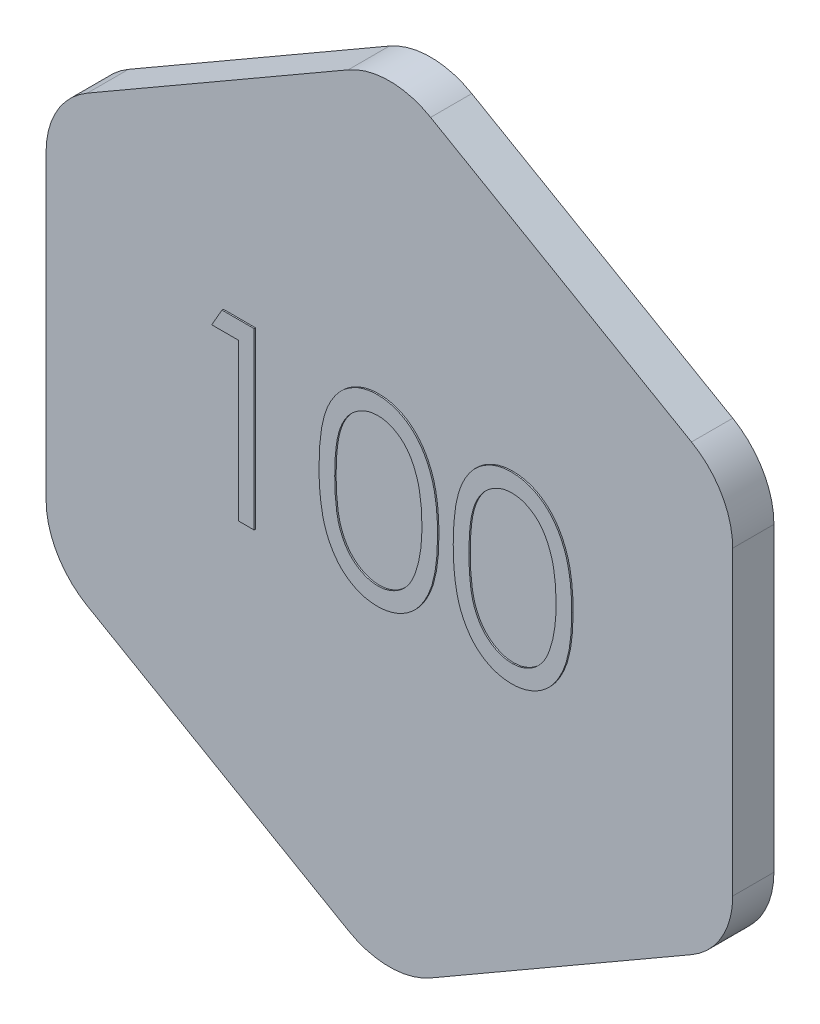
from build123d import *

# Parameters (mm, degrees)
BOSS_EXTRUDE2_DEPTH = 3
BOSS_EXTRUDE3_DEPTH = 0.1


with BuildPart() as part:
    # Sketch1 → Boss-Extrude2 (new body)
    with BuildSketch(Plane(origin=(0, 0, 0), x_dir=(0, 1, 0), z_dir=(0, 0, 1))):
        with BuildLine():
            Line((16.165807537, -22), (27.135462652, -3))
            ThreePointArc((27.135462652, -3), (27.939310229, 0), (27.135462652, 3))
            Line((27.135462652, 3), (16.165807537, 22))
            ThreePointArc((16.165807537, 22), (13.969655115, 24.196152423), (10.969655115, 25))
            Line((10.969655115, 25), (-10.969655115, 25))
            ThreePointArc((-10.969655115, 25), (-13.969655115, 24.196152423), (-16.165807537, 22))
            Line((-16.165807537, 22), (-27.135462652, 3))
            ThreePointArc((-27.135462652, 3), (-27.939310229, 0), (-27.135462652, -3))
            Line((-27.135462652, -3), (-16.165807537, -22))
            ThreePointArc((-16.165807537, -22), (-13.969655115, -24.196152423), (-10.969655115, -25))
            Line((-10.969655115, -25), (10.969655115, -25))
            ThreePointArc((10.969655115, -25), (13.969655115, -24.196152423), (16.165807537, -22))
        make_face()
    extrude(amount=BOSS_EXTRUDE2_DEPTH)

    # Sketch2 → Boss-Extrude3 (add)
    # profile 1 of 3: a face of its own
    with BuildSketch(Plane.XY.offset(3)):
        Polygon((-12.091106581, 7.490425422), (-9.742929497, 7.490425422), (-9.742929497, -5.209574578), (-10.882673087, -5.209574578), (-10.882673087, 6.18786132), (-12.836519241, 6.18786132), align=None)
    # profile 2 of 3: a face of its own
    with BuildSketch(Plane.XY.offset(3)):
        with BuildLine():
            add(Edge.make_bspline(
                [(-5.021134625, 1.135337281), (-5.019944388, 1.33889066), (-5.017632335, 1.734296031), (-4.991911493, 2.310457447), (-4.949183823, 2.850970495), (-4.890628213, 3.355861049), (-4.819370399, 3.825259452), (-4.724245633, 4.257911285), (-4.616067749, 4.655819), (-4.490691731, 5.020280148), (-4.349221754, 5.356204956), (-4.195246008, 5.669804972), (-4.022653754, 5.960605698), (-3.841308956, 6.233248537), (-3.643870867, 6.483270515), (-3.435958113, 6.714202462), (-3.209455877, 6.920707185), (-2.972063818, 7.108835197), (-2.721632647, 7.273751851), (-2.465300687, 7.419013503), (-2.201303589, 7.543110164), (-1.928920582, 7.640684031), (-1.650599872, 7.721277675), (-1.365368516, 7.776391857), (-1.072755567, 7.811069782), (-0.875247218, 7.814385091), (-0.77508094, 7.816066448)],
                knots=[0, 0, 0, 0, 1.646270934, 3.197905019, 4.663502075, 6.030701355, 7.308322542, 8.50163776, 9.611534131, 10.641858119, 11.616356847, 12.558055219, 13.465016945, 14.349605745, 15.204443733, 16.039544428, 16.859896111, 17.680448484, 18.487036065, 19.28249412, 20.06191084, 20.843045899, 21.620316918, 22.403196591, 23.190181807, 24, 24, 24, 24], degree=3))
            add(Edge.make_bspline(
                [(-0.77508094, 7.816066448), (-0.674077918, 7.814296376), (-0.473214685, 7.810776259), (-0.176251038, 7.776943668), (0.113852093, 7.720805592), (0.39585791, 7.64126377), (0.672082861, 7.542582315), (0.940366398, 7.418894776), (1.202374951, 7.274917171), (1.453944851, 7.105739102), (1.697837884, 6.9171177), (1.92806335, 6.703893159), (2.144642204, 6.468218463), (2.350292598, 6.212615129), (2.539180051, 5.932180678), (2.719060791, 5.631792622), (2.880067892, 5.30619777), (3.035133714, 4.960828644), (3.16898078, 4.586129082), (3.289689727, 4.184211237), (3.387221985, 3.750327759), (3.468463058, 3.286755097), (3.531400252, 2.791790801), (3.577238696, 2.266495885), (3.601452462, 1.710524753), (3.606012492, 1.330403414), (3.608352554, 1.135337281)],
                knots=[0, 0, 0, 0, 0.810914788, 1.612654377, 2.396697861, 3.181598691, 3.963628158, 4.749916497, 5.551656086, 6.361998678, 7.18212741, 8.025565596, 8.878627764, 9.750805457, 10.657531673, 11.591944965, 12.560506719, 13.57287815, 14.630710178, 15.753379473, 16.941251878, 18.199788006, 19.531962791, 20.947069417, 22.433333509, 24, 24, 24, 24], degree=3))
            add(Edge.make_bspline(
                [(3.608352554, 1.135337281), (3.605988233, 0.941121958), (3.60138145, 0.562701321), (3.577510142, 0.009231782), (3.530488824, -0.513275403), (3.471669723, -1.006073367), (3.3902048, -1.467111013), (3.290037483, -1.897983726), (3.178820597, -2.300552214), (3.041534344, -2.671518531), (2.891272624, -3.016057639), (2.727786626, -3.33779272), (2.552636114, -3.639567554), (2.361814097, -3.918966635), (2.158420283, -4.177969191), (1.93810145, -4.412003422), (1.707068184, -4.626708432), (1.462457418, -4.817758623), (1.206964075, -4.984980628), (0.945855424, -5.134528028), (0.674498576, -5.255115236), (0.399043005, -5.35865667), (0.115548648, -5.437761167), (-0.175631113, -5.492457729), (-0.473015169, -5.530818436), (-0.674043705, -5.533744806), (-0.77508094, -5.535215603)],
                knots=[0, 0, 0, 0, 1.561518951, 3.042555995, 4.452378317, 5.7783523, 7.031515105, 8.214008947, 9.334062868, 10.386615937, 11.391082383, 12.354592575, 13.286541444, 14.194233754, 15.072674879, 15.931287219, 16.775624067, 17.606195743, 18.42308326, 19.229000347, 20.022332153, 20.807536673, 21.593273796, 22.3848459, 23.188221202, 24, 24, 24, 24], degree=3))
            add(Edge.make_bspline(
                [(-0.77508094, -5.535215603), (-0.875244439, -5.533523399), (-1.072747309, -5.530186703), (-1.365400395, -5.495665449), (-1.649453833, -5.440164623), (-1.926309312, -5.362452945), (-2.197387238, -5.267330539), (-2.458993764, -5.143401459), (-2.714037645, -5.00067498), (-2.961838434, -4.838131593), (-3.197739704, -4.6519072), (-3.423068929, -4.445933924), (-3.632165427, -4.215071832), (-3.826780574, -3.962966225), (-4.011743694, -3.69193646), (-4.181885134, -3.398282078), (-4.339259376, -3.083167463), (-4.483108613, -2.744556758), (-4.61064805, -2.377508877), (-4.723306876, -1.977824715), (-4.812258248, -1.54197655), (-4.8883964, -1.073464961), (-4.949807733, -0.570276699), (-4.991733427, -0.03213859), (-5.017646199, 0.540614026), (-5.019950597, 0.933478635), (-5.021134625, 1.135337281)],
                knots=[0, 0, 0, 0, 0.810891512, 1.598919785, 2.382837074, 3.152667961, 3.926044502, 4.706494248, 5.493654104, 6.291793342, 7.103789334, 7.925228297, 8.761435821, 9.622817696, 10.50288917, 11.416980706, 12.369136599, 13.353924996, 14.394355917, 15.514179734, 16.714354668, 17.994756427, 19.357759367, 20.818452758, 22.365282078, 24, 24, 24, 24], degree=3))
        make_face()
        with BuildLine():
            add(Edge.make_bspline(
                [(-3.881391036, 1.140425422), (-3.880957613, 0.970794429), (-3.880116426, 0.641573981), (-3.85814107, 0.163171291), (-3.828204514, -0.28303533), (-3.789591807, -0.697612448), (-3.732249679, -1.079156779), (-3.667999335, -1.430292487), (-3.589810552, -1.749161318), (-3.497300059, -2.037951374), (-3.391929622, -2.301563709), (-3.276882631, -2.546859546), (-3.153290865, -2.776736573), (-3.014972804, -2.989129952), (-2.864332432, -3.184732319), (-2.70477232, -3.367005739), (-2.530337514, -3.529554785), (-2.289023934, -3.724506516), (-1.970448156, -3.925961659), (-1.569053932, -4.101388899), (-1.156599839, -4.211633812), (-0.876651017, -4.225653727), (-0.736919882, -4.232651501)],
                knots=[0, 0, 0, 0, 1.459021318, 2.831673884, 4.118529203, 5.306027144, 6.411944654, 7.436330062, 8.375795394, 9.233974572, 10.042671642, 10.816086306, 11.563610507, 12.285937304, 12.993564865, 13.685989202, 14.367179055, 15.041617293, 16.353048772, 17.594441528, 18.799311195, 20, 20, 20, 20], degree=3))
            add(Edge.make_bspline(
                [(-0.736919882, -4.232651501), (-0.596284902, -4.226853839), (-0.315305301, -4.215270485), (0.095208756, -4.103515067), (0.493735736, -3.934897024), (0.806053919, -3.735516075), (1.043662006, -3.545638994), (1.213903656, -3.383751556), (1.370157374, -3.202483123), (1.51835576, -3.006905678), (1.654278692, -2.793282664), (1.77787922, -2.56264132), (1.890667367, -2.31434116), (1.954925905, -2.141005249), (1.987779637, -2.052383071)],
                knots=[0, 0, 0, 0, 1.353760809, 2.704726607, 4.075137775, 5.516104923, 6.260822281, 7.007110065, 7.778089737, 8.566572457, 9.372053459, 10.217411131, 11.088608312, 12, 12, 12, 12], degree=3))
            add(Edge.make_bspline(
                [(1.987779637, -2.052383071), (2.026067481, -1.939063731), (2.103808222, -1.708976872), (2.203999517, -1.352057335), (2.282904252, -0.977578734), (2.353891322, -0.587779025), (2.402343839, -0.179783538), (2.441343047, 0.245145341), (2.464314397, 0.687327998), (2.467161922, 0.987755537), (2.468608964, 1.140425422)],
                knots=[0, 0, 0, 0, 0.884706709, 1.796334032, 2.740027952, 3.714592787, 4.726048262, 5.777819803, 6.87074269, 8, 8, 8, 8], degree=3))
            add(Edge.make_bspline(
                [(2.468608964, 1.140425422), (2.466612563, 1.293070614), (2.462707176, 1.59167724), (2.447779278, 2.028986067), (2.409230879, 2.444340514), (2.366416934, 2.839529944), (2.303289874, 3.212366756), (2.235225832, 3.56597215), (2.143781433, 3.895965411), (2.046101107, 4.207513036), (1.934303386, 4.497075411), (1.811237722, 4.766002579), (1.679804483, 5.015592866), (1.537048353, 5.245161482), (1.384664017, 5.455736709), (1.218629482, 5.643096524), (1.045530758, 5.813047808), (0.803079826, 6.007040559), (0.485673117, 6.20484014), (0.090718911, 6.386870183), (-0.320291712, 6.49140313), (-0.59814396, 6.506141252), (-0.736919882, 6.513502345)],
                knots=[0, 0, 0, 0, 1.31362396, 2.569729283, 3.763502607, 4.902122613, 5.988968491, 7.01645872, 7.998833611, 8.933434873, 9.825090667, 10.667526885, 11.477055099, 12.250526234, 12.991942729, 13.710640831, 14.402115721, 15.076753259, 16.378508321, 17.609869233, 18.806226677, 20, 20, 20, 20], degree=3))
            add(Edge.make_bspline(
                [(-0.736919882, 6.513502345), (-0.87738403, 6.506131096), (-1.158568219, 6.491375169), (-1.573850798, 6.387259649), (-1.971920874, 6.20578403), (-2.288488239, 6.006385421), (-2.531108264, 5.816472119), (-2.70195118, 5.651784129), (-2.862138719, 5.471639149), (-3.009704374, 5.274237915), (-3.147914059, 5.062092153), (-3.274845162, 4.833532921), (-3.389208044, 4.587401971), (-3.494743361, 4.323908048), (-3.587536049, 4.035142907), (-3.664077001, 3.716666845), (-3.734787165, 3.36664798), (-3.784844284, 2.983037194), (-3.829344198, 2.568356238), (-3.857942231, 2.121035683), (-3.880189937, 1.641830646), (-3.880982651, 1.310907985), (-3.881391036, 1.140425422)],
                knots=[0, 0, 0, 0, 1.207732386, 2.417664972, 3.655092373, 4.956220595, 5.625982001, 6.301752483, 6.994047911, 7.697131622, 8.419323945, 9.170223765, 9.943494443, 10.752040957, 11.610060368, 12.549350801, 13.567764191, 14.679664412, 15.874934091, 17.154273443, 18.533957287, 20, 20, 20, 20], degree=3))
        make_face(mode=Mode.SUBTRACT)
    # profile 3 of 3: a face of its own
    with BuildSketch(Plane.XY.offset(3)):
        with BuildLine():
            add(Edge.make_bspline(
                [(4.748096144, 1.135337281), (4.749286381, 1.33889066), (4.751598434, 1.734296031), (4.777319276, 2.310457447), (4.820046947, 2.850970495), (4.878602557, 3.355861049), (4.949860371, 3.825259452), (5.044985136, 4.257911285), (5.15316302, 4.655819), (5.278539038, 5.020280148), (5.420009015, 5.356204956), (5.573984761, 5.669804972), (5.746577015, 5.960605698), (5.927921813, 6.233248537), (6.125359902, 6.483270515), (6.333272656, 6.714202462), (6.559774893, 6.920707185), (6.797166951, 7.108835197), (7.047598122, 7.273751851), (7.303930082, 7.419013503), (7.56792718, 7.543110164), (7.840310187, 7.640684031), (8.118630897, 7.721277675), (8.403862253, 7.776391857), (8.696475202, 7.811069782), (8.893983552, 7.814385091), (8.99414983, 7.816066448)],
                knots=[0, 0, 0, 0, 1.646270934, 3.197905019, 4.663502075, 6.030701355, 7.308322542, 8.50163776, 9.611534131, 10.641858119, 11.616356847, 12.558055219, 13.465016945, 14.349605745, 15.204443733, 16.039544428, 16.859896111, 17.680448484, 18.487036065, 19.28249412, 20.06191084, 20.843045899, 21.620316918, 22.403196591, 23.190181807, 24, 24, 24, 24], degree=3))
            add(Edge.make_bspline(
                [(8.99414983, 7.816066448), (9.095152852, 7.814296376), (9.296016084, 7.810776259), (9.592979731, 7.776943668), (9.883082862, 7.720805592), (10.16508868, 7.64126377), (10.441313631, 7.542582315), (10.709597167, 7.418894776), (10.97160572, 7.274917171), (11.223175621, 7.105739102), (11.467068653, 6.9171177), (11.697294119, 6.703893159), (11.913872974, 6.468218463), (12.119523367, 6.212615129), (12.30841082, 5.932180678), (12.48829156, 5.631792622), (12.649298662, 5.30619777), (12.804364483, 4.960828644), (12.938211549, 4.586129082), (13.058920496, 4.184211237), (13.156452754, 3.750327759), (13.237693828, 3.286755097), (13.300631022, 2.791790801), (13.346469466, 2.266495885), (13.370683231, 1.710524753), (13.375243261, 1.330403414), (13.377583323, 1.135337281)],
                knots=[0, 0, 0, 0, 0.810914788, 1.612654377, 2.396697861, 3.181598691, 3.963628158, 4.749916497, 5.551656086, 6.361998678, 7.18212741, 8.025565596, 8.878627764, 9.750805457, 10.657531673, 11.591944965, 12.560506719, 13.57287815, 14.630710178, 15.753379473, 16.941251878, 18.199788006, 19.531962791, 20.947069417, 22.433333509, 24, 24, 24, 24], degree=3))
            add(Edge.make_bspline(
                [(13.377583323, 1.135337281), (13.375219002, 0.941121958), (13.370612219, 0.562701321), (13.346740912, 0.009231782), (13.299719593, -0.513275403), (13.240900492, -1.006073367), (13.15943557, -1.467111013), (13.059268252, -1.897983726), (12.948051366, -2.300552214), (12.810765113, -2.671518531), (12.660503393, -3.016057639), (12.497017396, -3.33779272), (12.321866884, -3.639567554), (12.131044866, -3.918966635), (11.927651053, -4.177969191), (11.707332219, -4.412003422), (11.476298953, -4.626708432), (11.231688187, -4.817758623), (10.976194844, -4.984980628), (10.715086193, -5.134528028), (10.443729345, -5.255115236), (10.168273774, -5.35865667), (9.884779417, -5.437761167), (9.593599656, -5.492457729), (9.2962156, -5.530818436), (9.095187064, -5.533744806), (8.99414983, -5.535215603)],
                knots=[0, 0, 0, 0, 1.561518951, 3.042555995, 4.452378317, 5.7783523, 7.031515105, 8.214008947, 9.334062868, 10.386615937, 11.391082383, 12.354592575, 13.286541444, 14.194233754, 15.072674879, 15.931287219, 16.775624067, 17.606195743, 18.42308326, 19.229000347, 20.022332153, 20.807536673, 21.593273796, 22.3848459, 23.188221202, 24, 24, 24, 24], degree=3))
            add(Edge.make_bspline(
                [(8.99414983, -5.535215603), (8.89398633, -5.533523399), (8.696483461, -5.530186703), (8.403830374, -5.495665449), (8.119776936, -5.440164623), (7.842921457, -5.362452945), (7.571843531, -5.267330539), (7.310237005, -5.143401459), (7.055193125, -5.00067498), (6.807392336, -4.838131593), (6.571491065, -4.6519072), (6.34616184, -4.445933924), (6.137065343, -4.215071832), (5.942450196, -3.962966225), (5.757487076, -3.69193646), (5.587345635, -3.398282078), (5.429971393, -3.083167463), (5.286122156, -2.744556758), (5.15858272, -2.377508877), (5.045923893, -1.977824715), (4.956972522, -1.54197655), (4.880834369, -1.073464961), (4.819423037, -0.570276699), (4.777497342, -0.03213859), (4.75158457, 0.540614026), (4.749280172, 0.933478635), (4.748096144, 1.135337281)],
                knots=[0, 0, 0, 0, 0.810891512, 1.598919785, 2.382837074, 3.152667961, 3.926044502, 4.706494248, 5.493654104, 6.291793342, 7.103789334, 7.925228297, 8.761435821, 9.622817696, 10.50288917, 11.416980706, 12.369136599, 13.353924996, 14.394355917, 15.514179734, 16.714354668, 17.994756427, 19.357759367, 20.818452758, 22.365282078, 24, 24, 24, 24], degree=3))
        make_face()
        with BuildLine():
            add(Edge.make_bspline(
                [(5.887839734, 1.140425422), (5.888273156, 0.970794429), (5.889114343, 0.641573981), (5.9110897, 0.163171291), (5.941026256, -0.28303533), (5.979638963, -0.697612448), (6.03698109, -1.079156779), (6.101231434, -1.430292487), (6.179420217, -1.749161318), (6.27193071, -2.037951374), (6.377301148, -2.301563709), (6.492348139, -2.546859546), (6.615939905, -2.776736573), (6.754257965, -2.989129952), (6.904898337, -3.184732319), (7.064458449, -3.367005739), (7.238893255, -3.529554785), (7.480206835, -3.724506516), (7.798782614, -3.925961659), (8.200176837, -4.101388899), (8.61263093, -4.211633812), (8.892579752, -4.225653727), (9.032310887, -4.232651501)],
                knots=[0, 0, 0, 0, 1.459021318, 2.831673884, 4.118529203, 5.306027144, 6.411944654, 7.436330062, 8.375795394, 9.233974572, 10.042671642, 10.816086306, 11.563610507, 12.285937304, 12.993564865, 13.685989202, 14.367179055, 15.041617293, 16.353048772, 17.594441528, 18.799311195, 20, 20, 20, 20], degree=3))
            add(Edge.make_bspline(
                [(9.032310887, -4.232651501), (9.172945867, -4.226853839), (9.453925469, -4.215270485), (9.864439525, -4.103515067), (10.262966505, -3.934897024), (10.575284689, -3.735516075), (10.812892775, -3.545638994), (10.983134425, -3.383751556), (11.139388143, -3.202483123), (11.287586529, -3.006905678), (11.423509461, -2.793282664), (11.547109989, -2.56264132), (11.659898136, -2.31434116), (11.724156674, -2.141005249), (11.757010407, -2.052383071)],
                knots=[0, 0, 0, 0, 1.353760809, 2.704726607, 4.075137775, 5.516104923, 6.260822281, 7.007110065, 7.778089737, 8.566572457, 9.372053459, 10.217411131, 11.088608312, 12, 12, 12, 12], degree=3))
            add(Edge.make_bspline(
                [(11.757010407, -2.052383071), (11.79529825, -1.939063731), (11.873038991, -1.708976872), (11.973230287, -1.352057335), (12.052135021, -0.977578734), (12.123122091, -0.587779025), (12.171574608, -0.179783538), (12.210573816, 0.245145341), (12.233545166, 0.687327998), (12.236392691, 0.987755537), (12.237839734, 1.140425422)],
                knots=[0, 0, 0, 0, 0.884706709, 1.796334032, 2.740027952, 3.714592787, 4.726048262, 5.777819803, 6.87074269, 8, 8, 8, 8], degree=3))
            add(Edge.make_bspline(
                [(12.237839734, 1.140425422), (12.235843333, 1.293070614), (12.231937946, 1.59167724), (12.217010047, 2.028986067), (12.178461649, 2.444340514), (12.135647703, 2.839529944), (12.072520644, 3.212366756), (12.004456601, 3.56597215), (11.913012203, 3.895965411), (11.815331876, 4.207513036), (11.703534155, 4.497075411), (11.580468491, 4.766002579), (11.449035252, 5.015592866), (11.306279122, 5.245161482), (11.153894787, 5.455736709), (10.987860251, 5.643096524), (10.814761527, 5.813047808), (10.572310595, 6.007040559), (10.254903887, 6.20484014), (9.859949681, 6.386870183), (9.448939057, 6.49140313), (9.171086809, 6.506141252), (9.032310887, 6.513502345)],
                knots=[0, 0, 0, 0, 1.31362396, 2.569729283, 3.763502607, 4.902122613, 5.988968491, 7.01645872, 7.998833611, 8.933434873, 9.825090667, 10.667526885, 11.477055099, 12.250526234, 12.991942729, 13.710640831, 14.402115721, 15.076753259, 16.378508321, 17.609869233, 18.806226677, 20, 20, 20, 20], degree=3))
            add(Edge.make_bspline(
                [(9.032310887, 6.513502345), (8.891846739, 6.506131096), (8.61066255, 6.491375169), (8.195379971, 6.387259649), (7.797309896, 6.20578403), (7.48074253, 6.006385421), (7.238122505, 5.816472119), (7.067279589, 5.651784129), (6.90709205, 5.471639149), (6.759526395, 5.274237915), (6.62131671, 5.062092153), (6.494385607, 4.833532921), (6.380022726, 4.587401971), (6.274487409, 4.323908048), (6.181694721, 4.035142907), (6.105153768, 3.716666845), (6.034443604, 3.36664798), (5.984386485, 2.983037194), (5.939886572, 2.568356238), (5.911288538, 2.121035683), (5.889040832, 1.641830646), (5.888248119, 1.310907985), (5.887839734, 1.140425422)],
                knots=[0, 0, 0, 0, 1.207732386, 2.417664972, 3.655092373, 4.956220595, 5.625982001, 6.301752483, 6.994047911, 7.697131622, 8.419323945, 9.170223765, 9.943494443, 10.752040957, 11.610060368, 12.549350801, 13.567764191, 14.679664412, 15.874934091, 17.154273443, 18.533957287, 20, 20, 20, 20], degree=3))
        make_face(mode=Mode.SUBTRACT)
    extrude(amount=BOSS_EXTRUDE3_DEPTH)


solid = part.part
